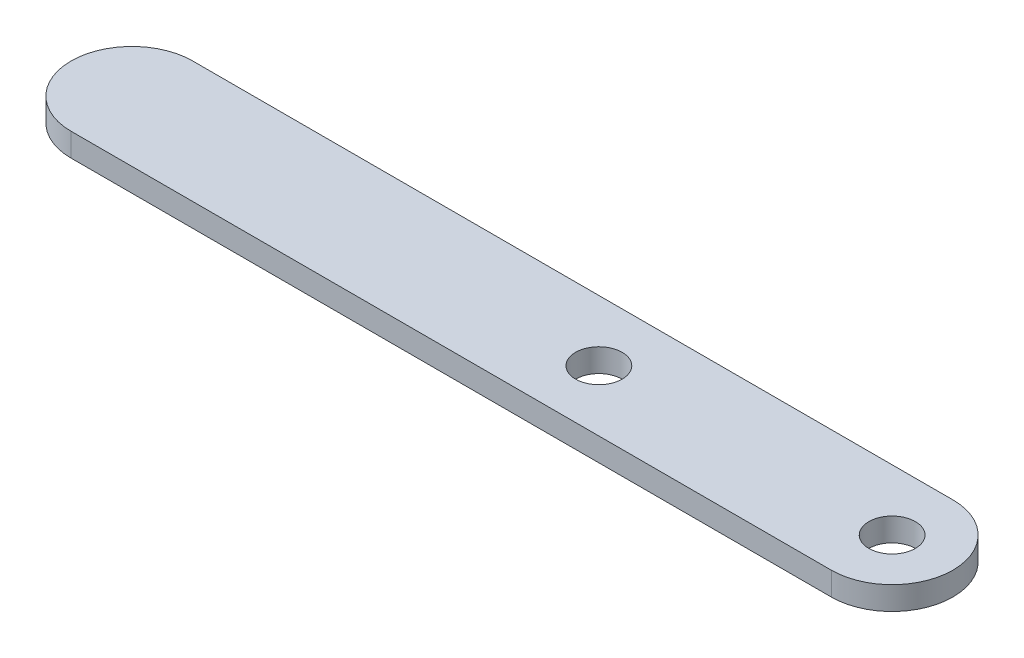
from build123d import *

# Parameters (mm, degrees)
SKETCH1_R           = 1.5875
BOSS_EXTRUDE1_DEPTH = 0.79375


with BuildPart() as part:
    # Sketch1 → Boss-Extrude1 (new, symmetric)
    with BuildSketch(Plane(origin=(0, 0, 0), x_dir=(1, 0, 0), z_dir=(0, 1, 0))):
        with BuildLine():
            Line((28, 4.15), (8, 4.15))
            Line((8, 4.15), (-23.85, 4.15))
            ThreePointArc((-23.85, 4.15), (-28, 0), (-23.85, -4.15))
            Line((-23.85, -4.15), (8, -4.15))
            Line((8, -4.15), (28, -4.15))
            ThreePointArc((28, -4.15), (32.15, 0), (28, 4.15))
        make_face()
        with Locations(Location((8, 0, 0), (0, 0, 270))):
            Circle(SKETCH1_R, mode=Mode.SUBTRACT)
        with Locations(Location((28, 0, 0), (0, 0, 270))):
            Circle(SKETCH1_R, mode=Mode.SUBTRACT)
    extrude(amount=BOSS_EXTRUDE1_DEPTH, both=True)


solid = part.part
